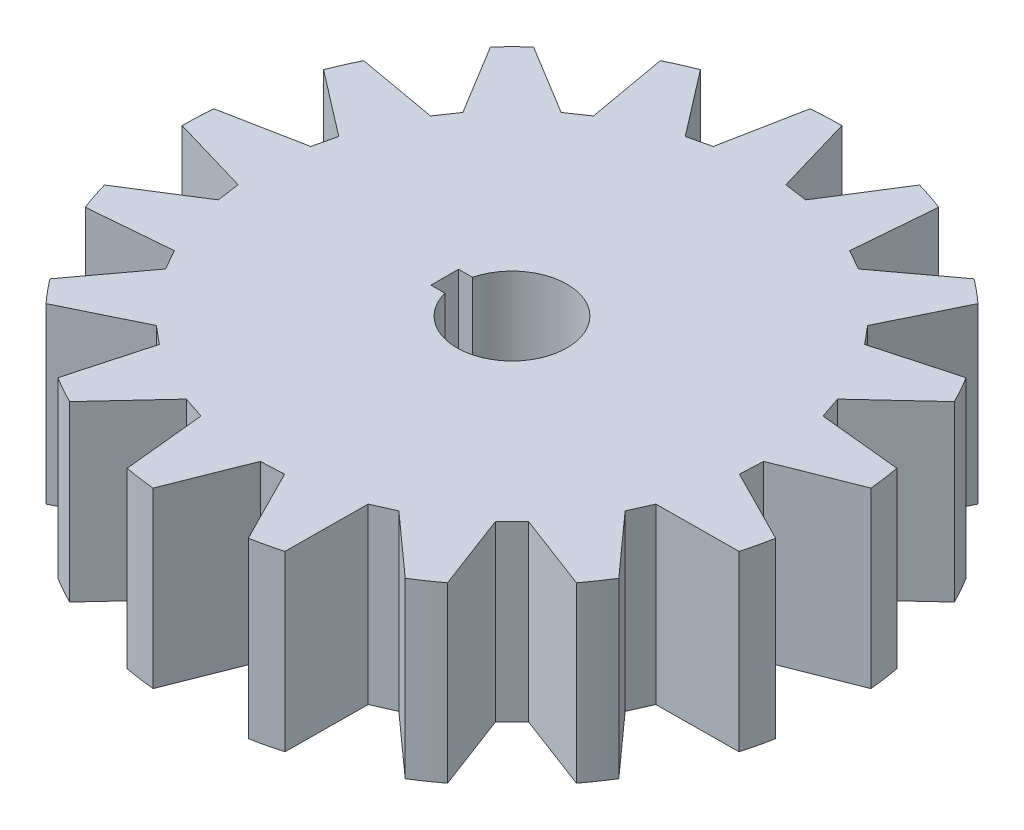
from build123d import *

# Parameters (mm, degrees)
ENL_V_MAT_EXTRU_3_DEPTH      = 115.682169495
R_P_TITION_CIRCULAIRE1_COUNT = 17
ENL_V_MAT_EXTRU_4_DEPTH      = 115.682169495


with BuildPart() as part:
    # Esquisse1 → Révolution1 (revolve)
    with BuildSketch(Plane.XY, mode=Mode.PRIVATE) as r_volution1_sk:
        Polygon((-76, 40), (-76, 0), (-50, 0), (0, 0), (0, 40), (-50, 40), align=None)
    revolve(r_volution1_sk.sketch.rotate(Axis((0, 40, 0), (0, -1, 0)), 270), axis=Axis((0, 40, 0), (0, -1, 0)))

    # Esquisse5 → Enlèv. mat.-Extru.3 (cut, through all)
    with BuildSketch(Plane(origin=(0, 40, 0), x_dir=(1, 0, 0), z_dir=(0, 1, 0))):
        with BuildLine():
            ThreePointArc((-7.01239532, 75.675797398), (-17.400241796, 73.981292131), (-27.45436663, 70.867889435))
            Line((-27.45436663, 70.867889435), (-15.872453425, 55.785887304))
            Line((-15.872453425, 55.785887304), (-10.657472034, 57.012439782))
            Line((-10.657472034, 57.012439782), (-7.01239532, 75.675797398))
        make_face()
    enl_v_mat_extru_3 = extrude(amount=-ENL_V_MAT_EXTRU_3_DEPTH, mode=Mode.SUBTRACT)

    # Répétition circulaire1: Enlèv. mat.-Extru.3 ×17 about axis
    r_p_tition_circulaire1_axis = Axis((0, 0, 0), (0, 1, 0))
    for i in range(1, R_P_TITION_CIRCULAIRE1_COUNT):
        add(enl_v_mat_extru_3.rotate(r_p_tition_circulaire1_axis, i * 360 / R_P_TITION_CIRCULAIRE1_COUNT), mode=Mode.SUBTRACT)

    # Esquisse6 → Enlèv. mat.-Extru.4 (cut, through all)
    with BuildSketch(Plane(origin=(0, 40, 0), x_dir=(1, 0, 0), z_dir=(0, 1, 0))):
        with BuildLine():
            Line((-12.296722124, 3.175), (-15.496722124, 3.175))
            Line((-15.496722124, 3.175), (-15.496722124, -3.175))
            Line((-15.496722124, -3.175), (-12.296722124, -3.175))
            ThreePointArc((-12.296722124, -3.175), (12.7, 0), (-12.296722124, 3.175))
        make_face()
    extrude(amount=-ENL_V_MAT_EXTRU_4_DEPTH, mode=Mode.SUBTRACT)


solid = part.part
